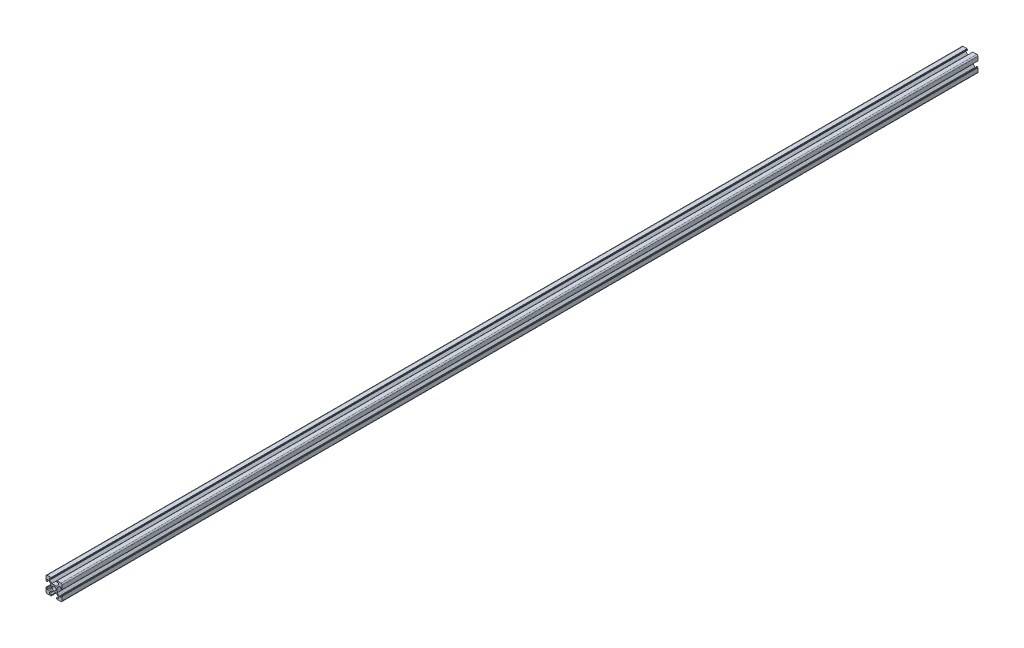
from build123d import *

# Parameters (mm, degrees)
SKETCH1_R                = 2.5
F_20_X_20_X_R1_5_1_DEPTH = 1144


with BuildPart() as part:
    # Sketch1 → 铝型材 20 X 20 X R1.5(1) (new body)
    with BuildSketch(Plane.YX):
        with BuildLine():
            Line((-3.6, 10), (-3.6, 9.5))
            Line((-3.6, 9.5), (-3.1, 9.5))
            Line((-3.1, 9.5), (-3.1, 8.5))
            Line((-3.1, 8.5), (-5.5, 8.5))
            Line((-5.5, 8.5), (-5.5, 6.65))
            Line((-5.5, 6.65), (-2.75, 3.9))
            Line((-2.75, 3.9), (2.75, 3.9))
            Line((2.75, 3.9), (5.5, 6.65))
            Line((5.5, 6.65), (5.5, 8.5))
            Line((5.5, 8.5), (3.1, 8.5))
            Line((3.1, 8.5), (3.1, 9.5))
            Line((3.1, 9.5), (3.6, 9.5))
            Line((3.6, 9.5), (3.6, 10))
            Line((3.6, 10), (8.5, 10))
            ThreePointArc((8.5, 10), (9.560660172, 9.560660172), (10, 8.5))
            Line((10, 8.5), (10, 3.6))
            Line((10, 3.6), (9.5, 3.6))
            Line((9.5, 3.6), (9.5, 3.1))
            Line((9.5, 3.1), (8.5, 3.1))
            Line((8.5, 3.1), (8.5, 5.5))
            Line((8.5, 5.5), (6.65, 5.5))
            Line((6.65, 5.5), (3.9, 2.75))
            Line((3.9, 2.75), (3.9, -2.75))
            Line((3.9, -2.75), (6.65, -5.5))
            Line((6.65, -5.5), (8.5, -5.5))
            Line((8.5, -5.5), (8.5, -3.1))
            Line((8.5, -3.1), (9.5, -3.1))
            Line((9.5, -3.1), (9.5, -3.6))
            Line((9.5, -3.6), (10, -3.6))
            Line((10, -3.6), (10, -8.5))
            ThreePointArc((10, -8.5), (9.560660172, -9.560660172), (8.5, -10))
            Line((8.5, -10), (3.6, -10))
            Line((3.6, -10), (3.6, -9.5))
            Line((3.6, -9.5), (3.1, -9.5))
            Line((3.1, -9.5), (3.1, -8.5))
            Line((3.1, -8.5), (5.5, -8.5))
            Line((5.5, -8.5), (5.5, -6.65))
            Line((5.5, -6.65), (2.75, -3.9))
            Line((2.75, -3.9), (-2.75, -3.9))
            Line((-2.75, -3.9), (-5.5, -6.65))
            Line((-5.5, -6.65), (-5.5, -8.5))
            Line((-5.5, -8.5), (-3.1, -8.5))
            Line((-3.1, -8.5), (-3.1, -9.5))
            Line((-3.1, -9.5), (-3.6, -9.5))
            Line((-3.6, -9.5), (-3.6, -10))
            Line((-3.6, -10), (-8.5, -10))
            ThreePointArc((-8.5, -10), (-9.560660172, -9.560660172), (-10, -8.5))
            Line((-10, -8.5), (-10, -3.6))
            Line((-10, -3.6), (-9.5, -3.6))
            Line((-9.5, -3.6), (-9.5, -3.1))
            Line((-9.5, -3.1), (-8.5, -3.1))
            Line((-8.5, -3.1), (-8.5, -5.5))
            Line((-8.5, -5.5), (-6.65, -5.5))
            Line((-6.65, -5.5), (-3.9, -2.75))
            Line((-3.9, -2.75), (-3.9, 2.75))
            Line((-3.9, 2.75), (-6.65, 5.5))
            Line((-6.65, 5.5), (-8.5, 5.5))
            Line((-8.5, 5.5), (-8.5, 3.1))
            Line((-8.5, 3.1), (-9.5, 3.1))
            Line((-9.5, 3.1), (-9.5, 3.6))
            Line((-9.5, 3.6), (-10, 3.6))
            Line((-10, 3.6), (-10, 8.5))
            ThreePointArc((-10, 8.5), (-9.560660172, 9.560660172), (-8.5, 10))
            Line((-8.5, 10), (-3.6, 10))
        make_face()
        Circle(SKETCH1_R, mode=Mode.SUBTRACT)
    extrude(amount=F_20_X_20_X_R1_5_1_DEPTH)


solid = part.part
